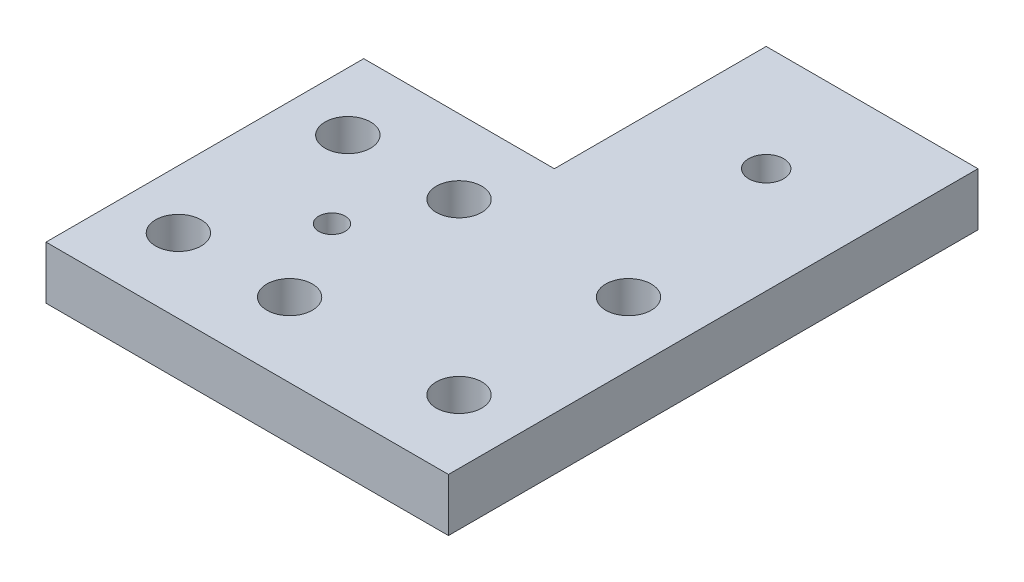
from build123d import *

# Parameters (mm, degrees)
AUFSATZ_LINEAR_AUSTRAGEN1_DEPTH = 5
DURCHGANGSLOCH_F_R_M41_D        = 4.3
DURCHGANGSLOCH_F_R_M42_D        = 4.3
M4_GEWINDEBOHRUNG1_D            = 3.3
M3_GEWINDEBOHRUNG1_D            = 2.5


with BuildPart() as part:
    # Skizze1 → Aufsatz-Linear austragen1 (new body)
    with BuildSketch(Plane(origin=(0, 0, 0), x_dir=(1, 0, 0), z_dir=(0, 1, 0))):
        Polygon((-9, 15), (-9, -15), (29, -15), (29, 35), (9, 35), (9, 15), align=None)
    extrude(amount=AUFSATZ_LINEAR_AUSTRAGEN1_DEPTH)

    # Durchgangsloch für M41 (through all)
    with Locations(Plane(origin=(0, 5, 0), x_dir=(1, 0, 0), z_dir=(0, 1, 0))):
        with Locations((7, 8), (23, 8), (7, -8), (23, -8)):
            Hole(DURCHGANGSLOCH_F_R_M41_D / 2)

    # Durchgangsloch für M42 (through all)
    with Locations(Plane(origin=(0, 5, 0), x_dir=(1, 0, 0), z_dir=(0, 1, 0))):
        with Locations((-3.5, 8), (-3.5, -8)):
            Hole(DURCHGANGSLOCH_F_R_M42_D / 2)

    # M4 Gewindebohrung1 (through all)
    with Locations(Plane(origin=(0, 5, 0), x_dir=(1, 0, 0), z_dir=(0, 1, 0))):
        with Locations((19, 25)):
            Hole(M4_GEWINDEBOHRUNG1_D / 2)

    # M3 Gewindebohrung1 (through all)
    with Locations(Plane(origin=(0, 5, 0), x_dir=(1, 0, 0), z_dir=(0, 1, 0))):
        with Locations((3, 0)):
            Hole(M3_GEWINDEBOHRUNG1_D / 2)


solid = part.part
